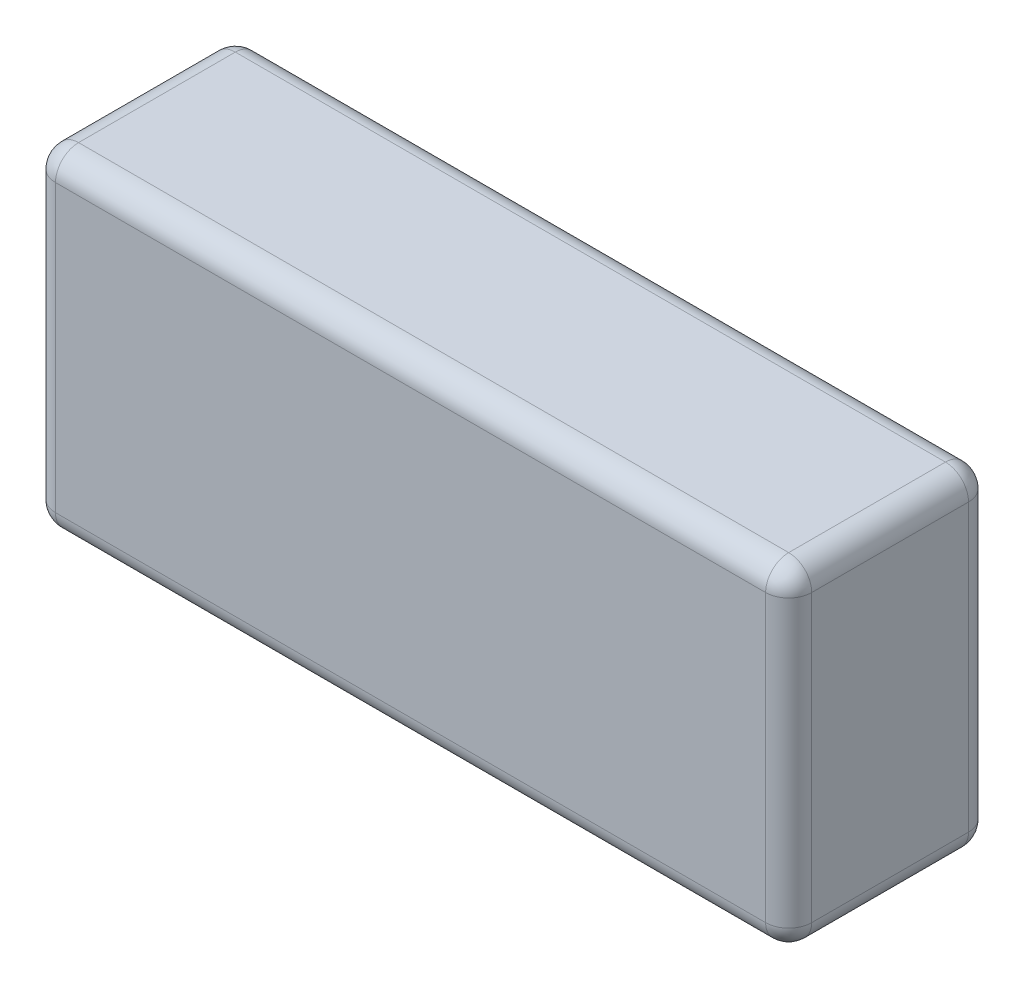
from build123d import *

# Parameters (mm, degrees)
SKETCH2_W           = 82
SKETCH2_H           = 36
BOSS_EXTRUDE1_DEPTH = 22
FILLET1_R           = 2.5
FILLET2_R           = 2.5


with BuildPart() as part:
    # Sketch2 → Boss-Extrude1 (new body)
    with BuildSketch(Plane.XY):
        with Locations((41, 18)):
            Rectangle(SKETCH2_W, SKETCH2_H)
    extrude(amount=BOSS_EXTRUDE1_DEPTH)

    # Fillet1
    fillet1_edges = [part.edges().sort_by_distance(p)[0] for p in [
        (41, 36, 22),
        (41, 36, 0),
        (41, 0, 0),
        (41, 0, 22),
    ]]
    fillet(fillet1_edges, radius=FILLET1_R)

    # Fillet2
    fillet2_edges = [part.edges().sort_by_distance(p)[0] for p in [
        (82, 0, 11),
        (0, 0, 11),
        (82, 18, 0),
        (82, 36, 11),
        (82, 18, 22),
        (82, 35.267766953, 21.267766953),
        (82, 35.267766953, 0.732233047),
        (82, 0.732233047, 21.267766953),
        (82, 0.732233047, 0.732233047),
        (0, 18, 0),
        (0, 18, 22),
        (0, 36, 11),
        (0, 35.267766953, 21.267766953),
        (0, 35.267766953, 0.732233047),
        (0, 0.732233047, 21.267766953),
        (0, 0.732233047, 0.732233047),
    ]]
    fillet(fillet2_edges, radius=FILLET2_R)


solid = part.part
